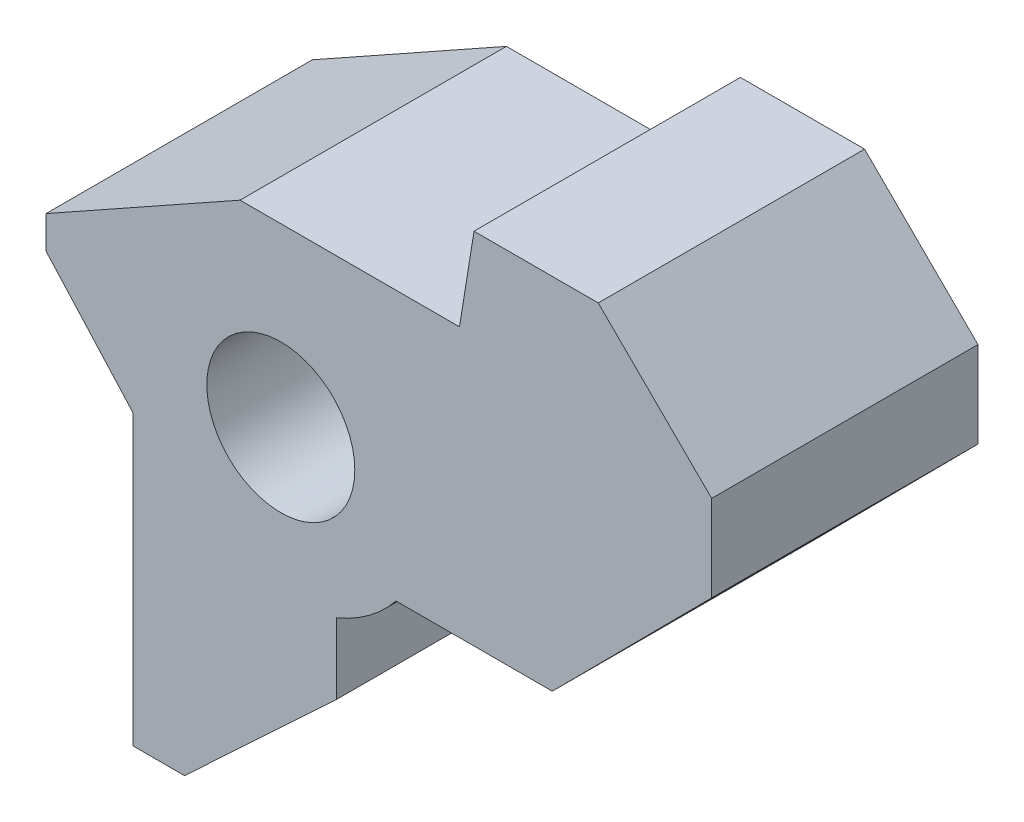
from build123d import *

# Parameters (mm, degrees)
SKETCH_1_R      = 2.5
EXTRUDE_1_DEPTH = 9


with BuildPart() as part:
    # 스케치1 → 보스-돌출1 (new body)
    with BuildSketch(Plane.XY):
        with BuildLine():
            Line((-7.933325128, 1.188242905), (-5, -2.066412243))
            Line((-5, -2.066412243), (-5, -11.820871263))
            Line((-5, -11.820871263), (-3.253479839, -11.820871263))
            Line((-3.253479839, -11.820871263), (1.87605446, -7.031414053))
            Line((1.87605446, -7.031414053), (1.87605446, -4.634697365))
            ThreePointArc((1.87605446, -4.634697365), (2.980195691, -4.014776911), (3.893195608, -3.13736003))
            Line((3.893195608, -3.13736003), (9.172978659, -3.13736003))
            Line((9.172978659, -3.13736003), (14.557074242, 2.286312605))
            Line((14.557074242, 2.286312605), (14.557074242, 5.198022376))
            Line((14.557074242, 5.198022376), (10.725649804, 9.001488547))
            Line((10.725649804, 9.001488547), (6.528593017, 9.001488547))
            Line((6.528593017, 9.001488547), (6.037882178, 5.957406269))
            Line((6.037882178, 5.957406269), (-1.376355668, 5.957406269))
            Line((-1.376355668, 5.957406269), (-7.933325128, 2.286312605))
            Line((-7.933325128, 2.286312605), (-7.933325128, 1.188242905))
        make_face()
        Circle(SKETCH_1_R, mode=Mode.SUBTRACT)
    extrude(amount=EXTRUDE_1_DEPTH)


solid = part.part
